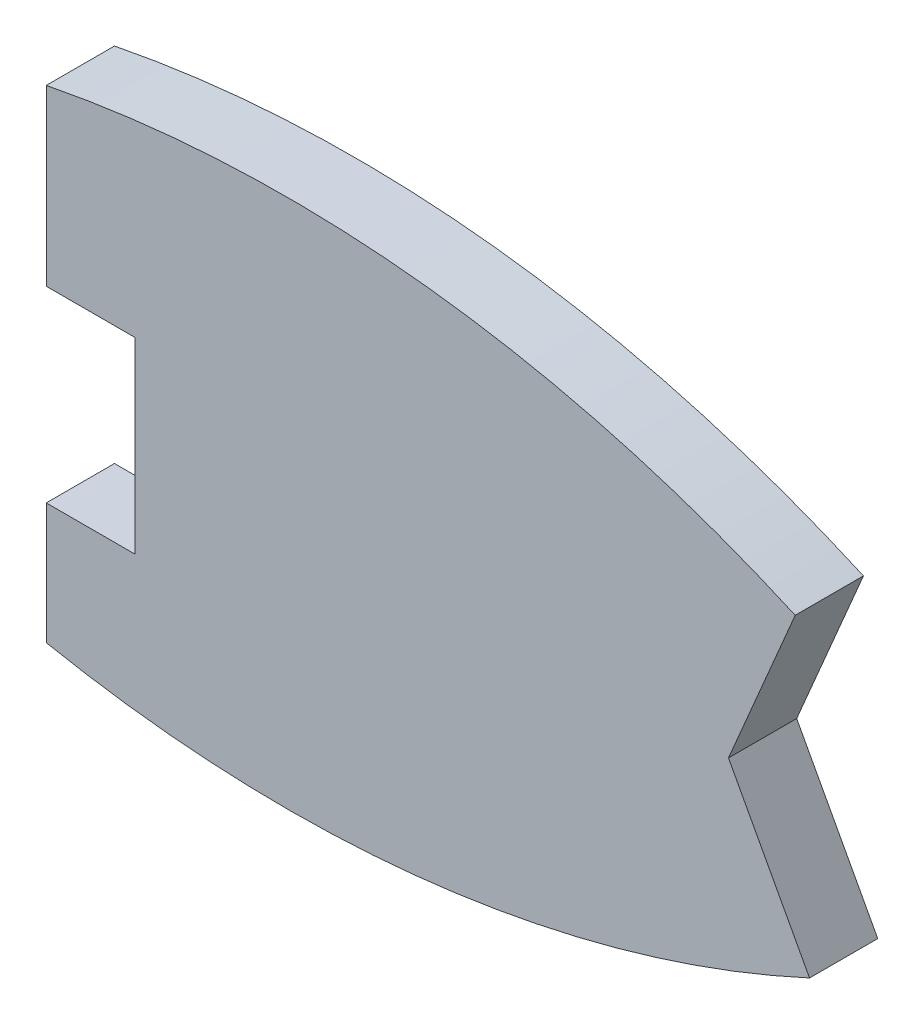
from build123d import *

# Parameters (mm, degrees)
BOSS_EXTRUDE1_DEPTH = 4


with BuildPart() as part:
    # Sketch1 → Boss-Extrude1 (new body)
    with BuildSketch(Plane.XY):
        with BuildLine():
            Line((0, 5.5), (-5.2, 5.5))
            Line((-5.2, 5.5), (-5.2, 15.7))
            ThreePointArc((-5.2, 15.7), (17.140820884, 16.628890564), (38.714781823, 10.751873901))
            Line((38.714781823, 10.751873901), (34.8, 1.55))
            Line((34.8, 1.55), (39.553207037, -7.248126099))
            ThreePointArc((39.553207037, -7.248126099), (17.599991723, -13.46450147), (-5.2, -12.6))
            Line((-5.2, -12.6), (-5.2, -5.5))
            Line((-5.2, -5.5), (0, -5.5))
            Line((0, -5.5), (0, 5.5))
        make_face()
    extrude(amount=BOSS_EXTRUDE1_DEPTH)


solid = part.part
